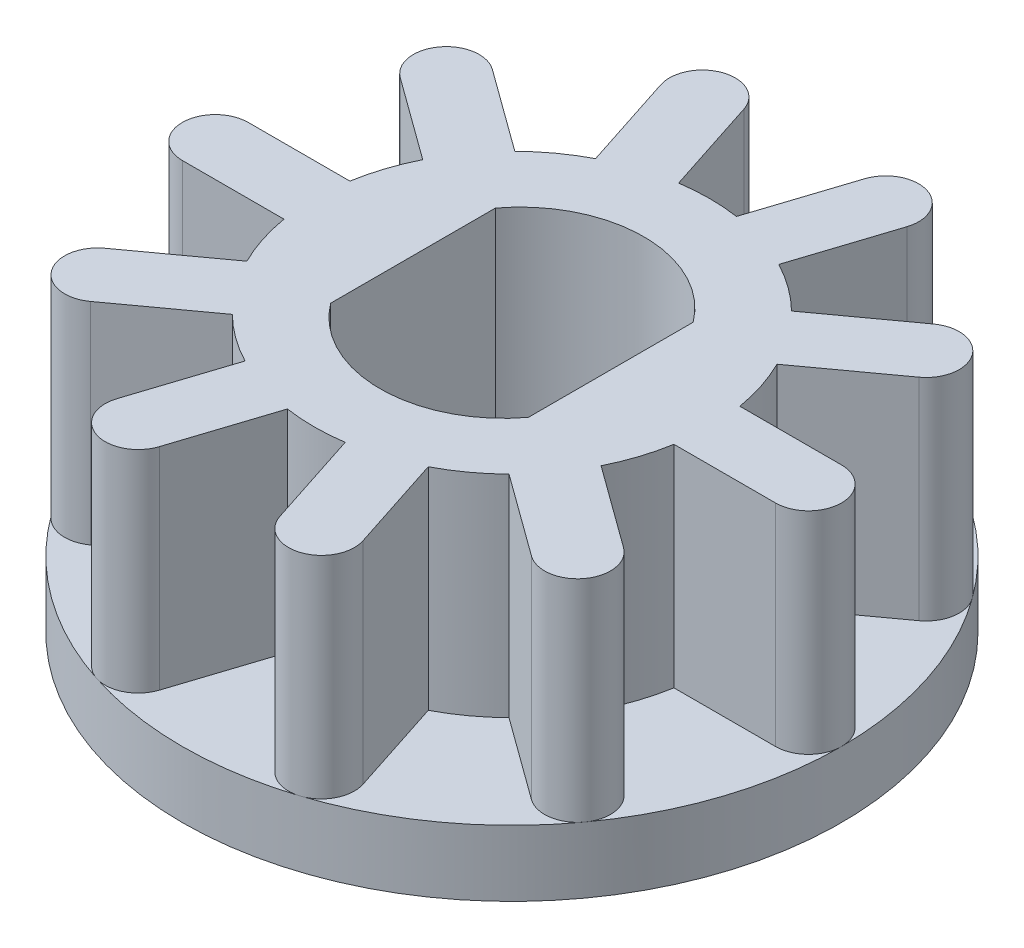
from build123d import *

# Parameters (mm, degrees)
SKETCH1_R           = 5
BOSS_EXTRUDE1_DEPTH = 4.2
CUT_EXTRUDE2_DEPTH  = 9.224354078
CUT_EXTRUDE4_START  = -3.2
SKETCH6_R           = 5
SKETCH6_R_2         = 3
CUT_EXTRUDE4_DEPTH  = 3.2
BOSS_EXTRUDE3_DEPTH = 3.2


with BuildPart() as part:
    # Sketch1 → Boss-Extrude1 (new body)
    with BuildSketch(Plane(origin=(0, 0, 0), x_dir=(1, 0, 0), z_dir=(0, 1, 0))):
        with Locations(Location((0, 0, 0), (0, 0, 270))):
            Circle(SKETCH1_R)
    extrude(amount=BOSS_EXTRUDE1_DEPTH)

    # Sketch2 → Cut-Extrude2 (cut, through all)
    with BuildSketch(Plane(origin=(0, 4.2, 0), x_dir=(1, 0, 0), z_dir=(0, 1, 0))):
        with BuildLine():
            Line((-1.5, 1.25), (-1.5, -1.25))
            ThreePointArc((-1.5, -1.25), (0, -2), (1.5, -1.25))
            Line((1.5, -1.25), (1.5, 1.25))
            ThreePointArc((1.5, 1.25), (0, 2), (-1.5, 1.25))
        make_face()
    extrude(amount=-CUT_EXTRUDE2_DEPTH, mode=Mode.SUBTRACT)

    # Sketch6 → Cut-Extrude4 (cut)
    with BuildSketch(Plane(origin=(0, 4.2, 0), x_dir=(1, 0, 0), z_dir=(0, 1, 0)).offset(CUT_EXTRUDE4_START)):
        with Locations(Location((0, 0, 0), (0, 0, 270))):
            Circle(SKETCH6_R)
        with Locations(Location((0, 0, 0), (0, 0, 270))):
            Circle(SKETCH6_R_2, mode=Mode.SUBTRACT)
    extrude(amount=CUT_EXTRUDE4_DEPTH, mode=Mode.SUBTRACT)

    # Sketch7 → Boss-Extrude3 (add)
    with BuildSketch(Plane(origin=(0, 1, 0), x_dir=(1, 0, 0), z_dir=(0, 1, 0))):
        with BuildLine():
            Line((-3.934469101, 2.240525138), (-2.686997168, 1.334183727))
            ThreePointArc((-2.686997168, 1.334183727), (-2.427050983, 1.763355757), (-2.099211916, 2.143200721))
            Line((-2.099211916, 2.143200721), (-3.346683849, 3.049542133))
            ThreePointArc((-3.346683849, 3.049542133), (-4.045084972, 2.938926261), (-3.934469101, 2.240525138))
        make_face()
        with BuildLine():
            ThreePointArc((-1.389612855, 2.658754617), (-0.927050983, 2.853169549), (-0.438556338, 2.967771612))
            Line((-0.438556338, 2.967771612), (-0.915048217, 4.434262821))
            ThreePointArc((-0.915048217, 4.434262821), (-1.545084972, 4.755282581), (-1.866104733, 4.125245826))
            Line((-1.866104733, 4.125245826), (-1.389612855, 2.658754617))
        make_face()
        with BuildLine():
            ThreePointArc((0.438556338, 2.967771612), (0.927050983, 2.853169549), (1.389612855, 2.658754617))
            Line((1.389612855, 2.658754617), (1.866104733, 4.125245826))
            ThreePointArc((1.866104733, 4.125245826), (1.545084972, 4.755282581), (0.915048217, 4.434262821))
            Line((0.915048217, 4.434262821), (0.438556338, 2.967771612))
        make_face()
        with BuildLine():
            ThreePointArc((2.099211916, 2.143200721), (2.427050983, 1.763355757), (2.686997168, 1.334183727))
            Line((2.686997168, 1.334183727), (3.934469101, 2.240525138))
            ThreePointArc((3.934469101, 2.240525138), (4.045084972, 2.938926261), (3.346683849, 3.049542133))
            Line((3.346683849, 3.049542133), (2.099211916, 2.143200721))
        make_face()
        with BuildLine():
            ThreePointArc((3, 0), (2.989491568, -0.250878781), (2.958039892, -0.5))
            Line((2.958039892, -0.5), (4.5, -0.5))
            ThreePointArc((4.5, -0.5), (5, 0), (4.5, 0.5))
            Line((4.5, 0.5), (2.958039892, 0.5))
            ThreePointArc((2.958039892, 0.5), (2.989491568, 0.250878781), (3, 0))
        make_face()
        with BuildLine():
            ThreePointArc((3.346683849, -3.049542133), (4.045084972, -2.938926261), (3.934469101, -2.240525138))
            Line((3.934469101, -2.240525138), (2.686997168, -1.334183727))
            ThreePointArc((2.686997168, -1.334183727), (2.427050983, -1.763355757), (2.099211916, -2.143200721))
            Line((2.099211916, -2.143200721), (3.346683849, -3.049542133))
        make_face()
        with BuildLine():
            Line((1.866104733, -4.125245826), (1.389612855, -2.658754617))
            ThreePointArc((1.389612855, -2.658754617), (0.927050983, -2.853169549), (0.438556338, -2.967771612))
            Line((0.438556338, -2.967771612), (0.915048217, -4.434262821))
            ThreePointArc((0.915048217, -4.434262821), (1.545084972, -4.755282581), (1.866104733, -4.125245826))
        make_face()
        with BuildLine():
            Line((-0.915048217, -4.434262821), (-0.438556338, -2.967771612))
            ThreePointArc((-0.438556338, -2.967771612), (-0.927050983, -2.853169549), (-1.389612855, -2.658754617))
            Line((-1.389612855, -2.658754617), (-1.866104733, -4.125245826))
            ThreePointArc((-1.866104733, -4.125245826), (-1.545084972, -4.755282581), (-0.915048217, -4.434262821))
        make_face()
        with BuildLine():
            Line((-3.346683849, -3.049542133), (-2.099211916, -2.143200721))
            ThreePointArc((-2.099211916, -2.143200721), (-2.427050983, -1.763355757), (-2.686997168, -1.334183727))
            Line((-2.686997168, -1.334183727), (-3.934469101, -2.240525138))
            ThreePointArc((-3.934469101, -2.240525138), (-4.045084972, -2.938926261), (-3.346683849, -3.049542133))
        make_face()
        with BuildLine():
            Line((-4.5, -0.5), (-2.958039892, -0.5))
            ThreePointArc((-2.958039892, -0.5), (-3, 0), (-2.958039892, 0.5))
            Line((-2.958039892, 0.5), (-4.5, 0.5))
            ThreePointArc((-4.5, 0.5), (-5, 0), (-4.5, -0.5))
        make_face()
    extrude(amount=BOSS_EXTRUDE3_DEPTH)


solid = part.part
